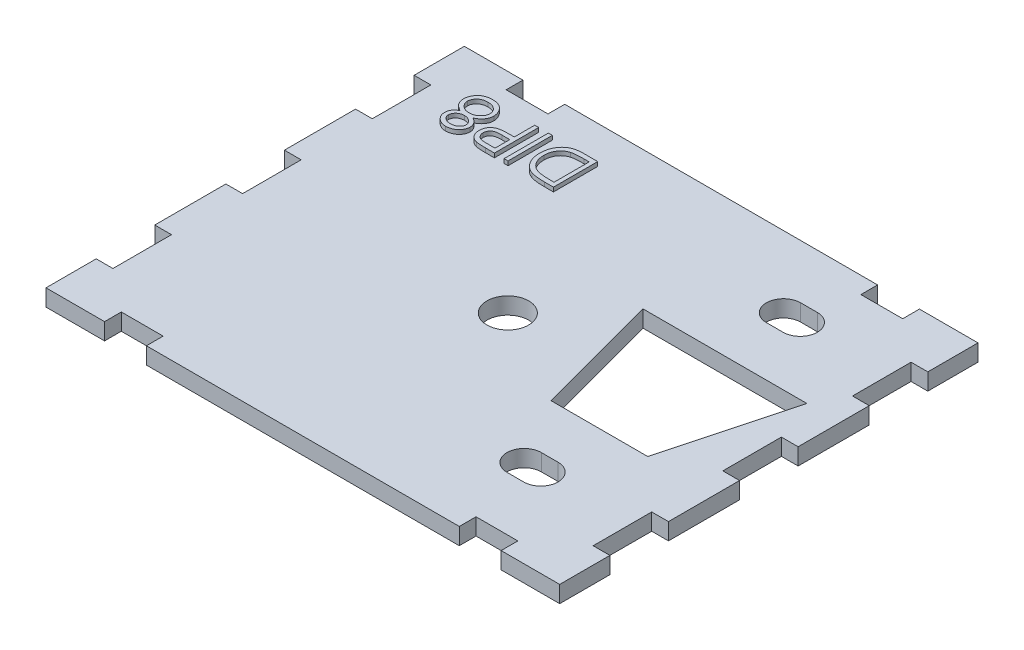
from build123d import *

# Parameters (mm, degrees)
SKETCH2_W           = 100
SKETCH2_H           = 50
BOSS_EXTRUDE1_DEPTH = 2
SKETCH12_W          = 9.8
SKETCH12_H          = 50
SKETCH12_W_2        = 8.8
CUT_EXTRUDE8_DEPTH  = 6
SKETCH13_W          = 2
SKETCH13_H          = 7
SKETCH13_W_2        = 5
SKETCH13_H_2        = 2
CUT_EXTRUDE10_DEPTH = 6
SKETCH15_W          = 6.543059906
SKETCH15_H          = 1
CUT_EXTRUDE13_DEPTH = 10
SKETCH16_R          = 2.5
CUT_EXTRUDE14_DEPTH = 10
SKETCH17_R          = 2.05
CUT_EXTRUDE15_DEPTH = 3.5
SKETCH22_W          = 0.474893163
SKETCH22_H          = 5.291666667
BOSS_EXTRUDE4_DEPTH = 0.5


with BuildPart() as part:
    # Sketch2 → Boss-Extrude1 (new body)
    with BuildSketch(Plane(origin=(0, 0, 0), x_dir=(1, 0, 0), z_dir=(0, 1, 0))):
        Rectangle(SKETCH2_W, SKETCH2_H)
    extrude(amount=BOSS_EXTRUDE1_DEPTH)

    # Sketch12 → Cut-Extrude8 (cut)
    with BuildSketch(Plane(origin=(0, 2, 0), x_dir=(1, 0, 0), z_dir=(0, 1, 0))):
        with Locations((-45.1, 0)):
            Rectangle(SKETCH12_W, SKETCH12_H)
        with Locations((45.6, 0)):
            Rectangle(SKETCH12_W_2, SKETCH12_H)
    extrude(amount=-CUT_EXTRUDE8_DEPTH, mode=Mode.SUBTRACT)

    # Sketch13 → Cut-Extrude10 (cut)
    with BuildSketch(Plane(origin=(0, 2, 0), x_dir=(1, 0, 0), z_dir=(0, 1, 0))):
        with Locations((-29.2, 0)):
            Rectangle(SKETCH13_W, SKETCH13_H)
        Polygon((-30.2, 12), (-30.2, 19), (-30.2, 25), (-40.2, 25), (-40.2, -25), (-30.2, -25), (-30.2, -19), (-30.2, -12), (-30.2, -3.5), (-30.2, 3.5), align=None)
        with Locations((-29.2, 15.5)):
            Rectangle(SKETCH13_W, SKETCH13_H)
        with Locations((21.7, -24)):
            Rectangle(SKETCH13_W_2, SKETCH13_H_2)
        with Locations((30.2, -15.5)):
            Rectangle(SKETCH13_W, SKETCH13_H)
        with Locations((30.2, 0)):
            Rectangle(SKETCH13_W, SKETCH13_H)
        with Locations((30.2, 15.5)):
            Rectangle(SKETCH13_W, SKETCH13_H)
        with Locations((21.7, 24)):
            Rectangle(SKETCH13_W_2, SKETCH13_H_2)
        with Locations((-29.2, -15.5)):
            Rectangle(SKETCH13_W, SKETCH13_H)
        Polygon((41.2, 25), (31.2, 25), (31.2, 19), (31.2, 12), (31.2, 3.5), (31.2, -3.5), (31.2, -12), (31.2, -19), (31.2, -25), (41.2, -25), align=None)
        with Locations((-20.7, 24)):
            Rectangle(SKETCH13_W_2, SKETCH13_H_2)
        with Locations((-20.7, -24)):
            Rectangle(SKETCH13_W_2, SKETCH13_H_2)
    extrude(amount=-CUT_EXTRUDE10_DEPTH, mode=Mode.SUBTRACT)

    # Sketch15 → Cut-Extrude13 (cut)
    with BuildSketch(Plane.XZ):
        Polygon((8.96933351, -7.5), (14.181143059, -7.5), (20.724202965, -7.5), (25.936012514, -7.5), (22.452673012, 5.5), (12.452673012, 5.5), align=None)
        Polygon((27.239237886, -8.5), (20.724202965, -8.5), (20.724202965, -7.5), (25.936012514, -7.5), (22.452673012, 5.5), (12.452673012, 5.5), (8.96933351, -7.5), (14.181143059, -7.5), (14.181143059, -8.5), (7.666108138, -8.5), (11.685346024, 6.5), (23.22, 6.5), align=None)
        with Locations((17.452673012, -8)):
            Rectangle(SKETCH15_W, SKETCH15_H)
    extrude(amount=-CUT_EXTRUDE13_DEPTH, mode=Mode.SUBTRACT)

    # Sketch16 → Cut-Extrude14 (cut)
    with BuildSketch(Plane(origin=(0, 0, 0), x_dir=(-1, 0, 0), z_dir=(0, -1, 0))):
        with Locations(Location((0, 0, 0), (0, 0, 90))):
            Circle(SKETCH16_R)
    extrude(amount=-CUT_EXTRUDE14_DEPTH, mode=Mode.SUBTRACT)

    # Sketch17 → Cut-Extrude15 (cut)
    with BuildSketch(Plane(origin=(0, 0, 0), x_dir=(-1, 0, 0), z_dir=(0, -1, 0))):
        with Locations((-18.452672874, -14.5)):
            Circle(SKETCH17_R)
        with Locations((-17.452672874, -14.5)):
            Circle(SKETCH17_R)
        with Locations((-16.452672874, -14.5)):
            Circle(SKETCH17_R)
        with BuildLine():
            ThreePointArc((-16.952672874, -12.511910465), (-16.704582037, -12.46553649), (-16.452672874, -12.45))
            Line((-16.452672874, -12.45), (-17.452672874, -12.45))
            ThreePointArc((-17.452672874, -12.45), (-17.200763711, -12.46553649), (-16.952672874, -12.511910465))
        make_face()
        with BuildLine():
            ThreePointArc((-17.952672874, -12.511910465), (-17.704582037, -12.46553649), (-17.452672874, -12.45))
            Line((-17.452672874, -12.45), (-18.452672874, -12.45))
            ThreePointArc((-18.452672874, -12.45), (-18.200763711, -12.46553649), (-17.952672874, -12.511910465))
        make_face()
        with BuildLine():
            Line((-17.452672874, -16.55), (-16.452672874, -16.55))
            ThreePointArc((-16.452672874, -16.55), (-16.704582037, -16.53446351), (-16.952672874, -16.488089535))
            ThreePointArc((-16.952672874, -16.488089535), (-17.200763711, -16.53446351), (-17.452672874, -16.55))
        make_face()
        with BuildLine():
            ThreePointArc((-17.952672874, -16.488089535), (-18.200763711, -16.53446351), (-18.452672874, -16.55))
            Line((-18.452672874, -16.55), (-17.452672874, -16.55))
            ThreePointArc((-17.452672874, -16.55), (-17.704582037, -16.53446351), (-17.952672874, -16.488089535))
        make_face()
        with Locations((-16.452672903, 16.5)):
            Circle(SKETCH17_R)
        with Locations((-18.452672903, 16.5)):
            Circle(SKETCH17_R)
        with Locations((-17.452672903, 16.5)):
            Circle(SKETCH17_R)
        with BuildLine():
            Line((-17.452672903, 14.45), (-16.452672903, 14.45))
            ThreePointArc((-16.452672903, 14.45), (-16.704582066, 14.46553649), (-16.952672903, 14.511910465))
            ThreePointArc((-16.952672903, 14.511910465), (-17.20076374, 14.46553649), (-17.452672903, 14.45))
        make_face()
        with BuildLine():
            ThreePointArc((-17.952672903, 14.511910465), (-18.20076374, 14.46553649), (-18.452672903, 14.45))
            Line((-18.452672903, 14.45), (-17.452672903, 14.45))
            ThreePointArc((-17.452672903, 14.45), (-17.704582066, 14.46553649), (-17.952672903, 14.511910465))
        make_face()
        with BuildLine():
            ThreePointArc((-17.952672903, 18.488089535), (-17.704582066, 18.53446351), (-17.452672903, 18.55))
            Line((-17.452672903, 18.55), (-18.452672903, 18.55))
            ThreePointArc((-18.452672903, 18.55), (-18.20076374, 18.53446351), (-17.952672903, 18.488089535))
        make_face()
        with BuildLine():
            ThreePointArc((-16.952672903, 18.488089535), (-16.704582066, 18.53446351), (-16.452672903, 18.55))
            Line((-16.452672903, 18.55), (-17.452672903, 18.55))
            ThreePointArc((-17.452672903, 18.55), (-17.20076374, 18.53446351), (-16.952672903, 18.488089535))
        make_face()
    extrude(amount=-CUT_EXTRUDE15_DEPTH, mode=Mode.SUBTRACT)

    # Sketch22 → Boss-Extrude4 (add)
    # profile 1 of 4: a face of its own
    with BuildSketch(Plane(origin=(0, 2, 0), x_dir=(1, 0, 0), z_dir=(0, 1, 0))):
        with BuildLine():
            add(Edge.make_bspline(
                [(-23.289435803, 17.591903377), (-23.332404905, 17.61448406), (-23.416471147, 17.658661691), (-23.536226688, 17.730009944), (-23.647999479, 17.802604298), (-23.749722211, 17.879054809), (-23.842392171, 17.957736407), (-23.926294543, 18.038440897), (-24.002331643, 18.120913039), (-24.067891265, 18.207273039), (-24.126059508, 18.295985161), (-24.175335145, 18.388142762), (-24.218340263, 18.482414147), (-24.252093921, 18.580230551), (-24.279961434, 18.680250068), (-24.299121538, 18.783814795), (-24.309429202, 18.890228595), (-24.31137761, 18.962147422), (-24.312364155, 18.998562365)],
                knots=[0, 0, 0, 0, 1.264219729, 2.473363326, 3.62979159, 4.734286947, 5.785533755, 6.79450939, 7.765315851, 8.704182021, 9.615576613, 10.525715488, 11.423813905, 12.311666436, 13.218214638, 14.126256791, 15.051260205, 16, 16, 16, 16], degree=3))
            add(Edge.make_bspline(
                [(-24.312364155, 18.998562365), (-24.311204378, 19.049512323), (-24.308908743, 19.150361407), (-24.288705392, 19.299170633), (-24.258862371, 19.444279836), (-24.213527962, 19.584044036), (-24.15774182, 19.719654049), (-24.087347083, 19.849282845), (-24.007897509, 19.976651469), (-23.944003353, 20.054992402), (-23.911673049, 20.094632744)],
                knots=[0, 0, 0, 0, 1.02531512, 2.029483338, 3.018748588, 4.004195107, 4.983200899, 5.966616707, 6.971112471, 8, 8, 8, 8], degree=3))
            add(Edge.make_bspline(
                [(-23.911673049, 20.094632744), (-23.869586951, 20.140887617), (-23.785934825, 20.232825779), (-23.642632065, 20.352191884), (-23.485360884, 20.452505849), (-23.314729833, 20.534257404), (-23.131195025, 20.597887215), (-22.934795566, 20.643611021), (-22.725148573, 20.669800885), (-22.581055777, 20.673586679), (-22.50713412, 20.675528845)],
                knots=[0, 0, 0, 0, 0.954267603, 1.896743057, 2.838368354, 3.796610408, 4.779680527, 5.799409237, 6.871065594, 8, 8, 8, 8], degree=3))
            add(Edge.make_bspline(
                [(-22.50713412, 20.675528845), (-22.436055991, 20.673781732), (-22.297745171, 20.670382028), (-22.096400606, 20.64747387), (-21.908487986, 20.606917675), (-21.733116378, 20.552556064), (-21.57198157, 20.480063565), (-21.424790588, 20.391208922), (-21.289386079, 20.287998182), (-21.170015852, 20.167947464), (-21.064068193, 20.039336519), (-20.970919412, 19.906693561), (-20.893932238, 19.770115131), (-20.827575478, 19.631678729), (-20.778193171, 19.488579337), (-20.743167977, 19.342285484), (-20.72116727, 19.193212775), (-20.718224786, 19.09262613), (-20.716744497, 19.04202357)],
                knots=[0, 0, 0, 0, 1.256864279, 2.445730223, 3.576845088, 4.651810441, 5.686528262, 6.692706664, 7.686234615, 8.689148594, 9.678739427, 10.630299996, 11.55097961, 12.448208961, 13.341360817, 14.221834469, 15.105450545, 16, 16, 16, 16], degree=3))
            add(Edge.make_bspline(
                [(-20.716744497, 19.04202357), (-20.717618412, 19.004892494), (-20.719345576, 18.931508382), (-20.731293861, 18.823089499), (-20.750519307, 18.717568868), (-20.776571554, 18.61452999), (-20.812202555, 18.514516547), (-20.854473631, 18.417012756), (-20.904236832, 18.322021441), (-20.963451698, 18.230988823), (-21.028691128, 18.140690304), (-21.106136334, 18.055609622), (-21.190624087, 17.970749255), (-21.287183971, 17.891269556), (-21.390601042, 17.810604383), (-21.505698429, 17.735495922), (-21.628638317, 17.660082318), (-21.716038773, 17.615019626), (-21.760873437, 17.591903377)],
                knots=[0, 0, 0, 0, 0.941575622, 1.860885767, 2.762557628, 3.660168386, 4.552890429, 5.45184204, 6.353736508, 7.268493418, 8.204037487, 9.175167802, 10.182660057, 11.238220596, 12.344046335, 13.507168087, 14.721227736, 16, 16, 16, 16], degree=3))
            add(Edge.make_bspline(
                [(-21.760873437, 17.591903377), (-21.699577858, 17.558340511), (-21.581078052, 17.493455028), (-21.422672491, 17.375729424), (-21.288489585, 17.245915039), (-21.179955341, 17.103816516), (-21.09426206, 16.95410414), (-21.033675933, 16.797566068), (-20.994129984, 16.635948219), (-20.990123942, 16.52574089), (-20.988112018, 16.470392293)],
                knots=[0, 0, 0, 0, 1.16701039, 2.256125286, 3.287752239, 4.277689688, 5.235169525, 6.160862735, 7.076343936, 8, 8, 8, 8], degree=3))
            add(Edge.make_bspline(
                [(-20.988112018, 16.470392293), (-20.99058901, 16.414004539), (-20.995568195, 16.30065532), (-21.035692113, 16.131877426), (-21.101573472, 15.966019636), (-21.18964704, 15.803466302), (-21.301731542, 15.651624337), (-21.434399213, 15.514337341), (-21.587483171, 15.395158449), (-21.757618679, 15.294413112), (-21.940381157, 15.212025645), (-22.133537089, 15.155780959), (-22.333643963, 15.118788779), (-22.46986568, 15.114612288), (-22.538935002, 15.112494657)],
                knots=[0, 0, 0, 0, 0.888724595, 1.786491426, 2.720083884, 3.697804067, 4.69440576, 5.687697823, 6.7000873, 7.744853364, 8.800284131, 9.853047784, 10.91141782, 12, 12, 12, 12], degree=3))
            add(Edge.make_bspline(
                [(-22.538935002, 15.112494657), (-22.606223043, 15.114671942), (-22.738907394, 15.1189653), (-22.934231025, 15.155126734), (-23.121279065, 15.21484513), (-23.299003181, 15.296181802), (-23.463621786, 15.397529675), (-23.610117107, 15.518020117), (-23.739685062, 15.65381121), (-23.846731579, 15.806153981), (-23.932605497, 15.968696476), (-23.994444609, 16.137306704), (-24.0335398, 16.30996329), (-24.038507636, 16.426729958), (-24.040996634, 16.485232704)],
                knots=[0, 0, 0, 0, 1.072634126, 2.115112298, 3.156050586, 4.19761425, 5.225177188, 6.230426315, 7.215180151, 8.209739481, 9.190420596, 10.139012357, 11.067603024, 12, 12, 12, 12], degree=3))
            add(Edge.make_bspline(
                [(-24.040996634, 16.485232704), (-24.038814594, 16.542644763), (-24.034529192, 16.655398782), (-23.998954414, 16.819531188), (-23.938110498, 16.972926268), (-23.856031863, 17.11794444), (-23.748301785, 17.252268321), (-23.617095434, 17.376565011), (-23.464115364, 17.493265493), (-23.348963868, 17.558289128), (-23.289435803, 17.591903377)],
                knots=[0, 0, 0, 0, 0.975463758, 1.915755378, 2.838359076, 3.772025586, 4.738400888, 5.753889765, 6.838863581, 8, 8, 8, 8], degree=3))
        make_face()
        with BuildLine():
            add(Edge.make_bspline(
                [(-22.512434267, 15.655229699), (-22.47531449, 15.656211427), (-22.402691974, 15.658132116), (-22.296228701, 15.668244), (-22.194907486, 15.687667345), (-22.098174266, 15.714277066), (-22.005697671, 15.747384889), (-21.919598353, 15.791005575), (-21.836982884, 15.839490149), (-21.760561541, 15.896360348), (-21.691380821, 15.958406963), (-21.629590243, 16.023204881), (-21.579250098, 16.092664313), (-21.535940626, 16.163310298), (-21.503777294, 16.238073053), (-21.480929572, 16.315315625), (-21.464760061, 16.395527264), (-21.463594687, 16.45017091), (-21.463005181, 16.477812499)],
                knots=[0, 0, 0, 0, 1.20353747, 2.354645537, 3.462130888, 4.543058862, 5.604822423, 6.639552563, 7.666902586, 8.706944258, 9.720926464, 10.677177239, 11.602682187, 12.496457588, 13.358248655, 14.231532794, 15.105417644, 16, 16, 16, 16], degree=3))
            add(Edge.make_bspline(
                [(-21.463005181, 16.477812499), (-21.464080303, 16.505438436), (-21.466204899, 16.560031256), (-21.481582796, 16.640972731), (-21.507294769, 16.719478164), (-21.542551413, 16.796280423), (-21.587796714, 16.871182371), (-21.642711, 16.944471028), (-21.709676985, 17.014208335), (-21.78362764, 17.082372873), (-21.864405646, 17.14517387), (-21.949288635, 17.201271158), (-22.03889609, 17.245991422), (-22.130544476, 17.285201955), (-22.226171939, 17.314614401), (-22.32511912, 17.335804335), (-22.427280324, 17.348911631), (-22.496495028, 17.350482111), (-22.531514796, 17.351276708)],
                knots=[0, 0, 0, 0, 0.873213166, 1.72559466, 2.594724523, 3.479581045, 4.391597569, 5.35687048, 6.368548091, 7.443976143, 8.534559525, 9.600545123, 10.654815915, 11.696401765, 12.749428718, 13.812189468, 14.893058657, 16, 16, 16, 16], degree=3))
            add(Edge.make_bspline(
                [(-22.531514796, 17.351276708), (-22.576496813, 17.349963671), (-22.666016561, 17.347350566), (-22.797934775, 17.322833119), (-22.926524557, 17.284755207), (-23.049352767, 17.230710492), (-23.164221069, 17.164816998), (-23.267889704, 17.087110128), (-23.356020332, 16.995764996), (-23.430997068, 16.896080311), (-23.489618261, 16.790338942), (-23.534523013, 16.683790582), (-23.560967949, 16.575557598), (-23.564405573, 16.503033178), (-23.566103471, 16.467212205)],
                knots=[0, 0, 0, 0, 1.076561449, 2.142489767, 3.202892658, 4.283174188, 5.348766409, 6.369549039, 7.375093932, 8.378927502, 9.349008457, 10.26378795, 11.142457041, 12, 12, 12, 12], degree=3))
            add(Edge.make_bspline(
                [(-23.566103471, 16.467212205), (-23.565314167, 16.442066926), (-23.563747511, 16.392157152), (-23.550314376, 16.318212536), (-23.529362787, 16.245904034), (-23.498822884, 16.175656129), (-23.46187911, 16.1058369), (-23.414787797, 16.03863664), (-23.360211652, 15.972021681), (-23.297362791, 15.908184689), (-23.22635654, 15.848252806), (-23.146618515, 15.796301252), (-23.058852377, 15.752979436), (-22.964234769, 15.716583757), (-22.861765786, 15.689552381), (-22.752327664, 15.669210289), (-22.634932936, 15.65776836), (-22.554152771, 15.656094273), (-22.512434267, 15.655229699)],
                knots=[0, 0, 0, 0, 0.814035228, 1.61574325, 2.427118093, 3.24780647, 4.092880925, 4.981933388, 5.900917883, 6.880367106, 7.87994501, 8.905470125, 9.95492938, 11.0455354, 12.184050453, 13.382997595, 14.64846247, 16, 16, 16, 16], degree=3))
        make_face(mode=Mode.SUBTRACT)
        with BuildLine():
            add(Edge.make_bspline(
                [(-22.543175119, 17.894011751), (-22.496116025, 17.894849043), (-22.403797565, 17.896491606), (-22.268545382, 17.914766395), (-22.138750223, 17.940223154), (-22.014810536, 17.978778768), (-21.897362521, 18.028944861), (-21.784753311, 18.088433254), (-21.678746335, 18.159735969), (-21.579815409, 18.241123996), (-21.489241489, 18.329322244), (-21.409489888, 18.422471375), (-21.342111092, 18.519306541), (-21.287432444, 18.619950223), (-21.245014196, 18.724180672), (-21.213708873, 18.832058714), (-21.195533045, 18.943885259), (-21.192943361, 19.019699148), (-21.191637659, 19.05792401)],
                knots=[0, 0, 0, 0, 1.140332253, 2.237053636, 3.304055028, 4.344690294, 5.377465719, 6.397042765, 7.428360044, 8.469453732, 9.499453352, 10.490108612, 11.438398528, 12.354680514, 13.261581007, 14.161901135, 15.073242693, 16, 16, 16, 16], degree=3))
            add(Edge.make_bspline(
                [(-21.191637659, 19.05792401), (-21.193736865, 19.105436245), (-21.197916883, 19.200044447), (-21.229889104, 19.339513735), (-21.282396734, 19.474495236), (-21.356058748, 19.603085246), (-21.445909182, 19.723724669), (-21.555139911, 19.83036229), (-21.681087775, 19.921562602), (-21.822718051, 19.997787354), (-21.977972565, 20.058158391), (-22.145891871, 20.101349747), (-22.325338543, 20.12849734), (-22.449086216, 20.131339079), (-22.512434267, 20.132793802)],
                knots=[0, 0, 0, 0, 0.899105568, 1.790333855, 2.694925079, 3.632758987, 4.588257081, 5.534574046, 6.511571685, 7.523527334, 8.572244311, 9.657983075, 10.801090915, 12, 12, 12, 12], degree=3))
            add(Edge.make_bspline(
                [(-22.512434267, 20.132793802), (-22.561946272, 20.131832001), (-22.658411534, 20.129958104), (-22.79919616, 20.113761674), (-22.931741394, 20.087305183), (-23.05731706, 20.051433018), (-23.174988471, 20.00388132), (-23.284595238, 19.944817552), (-23.387629904, 19.877353963), (-23.479688966, 19.797482909), (-23.563393287, 19.71201594), (-23.636711674, 19.622016397), (-23.698761577, 19.528385631), (-23.74877976, 19.431178451), (-23.788498975, 19.330752085), (-23.817132006, 19.226694282), (-23.834779351, 19.118596315), (-23.836565569, 19.045270882), (-23.837470993, 19.00810263)],
                knots=[0, 0, 0, 0, 1.224631902, 2.385975653, 3.500340538, 4.565441647, 5.612488581, 6.63322211, 7.641830068, 8.652595074, 9.641693811, 10.598750962, 11.520088299, 12.415429315, 13.298523938, 14.187139574, 15.081071174, 16, 16, 16, 16], degree=3))
            add(Edge.make_bspline(
                [(-23.837470993, 19.00810263), (-23.836110484, 18.971998254), (-23.833427799, 18.900806732), (-23.816156573, 18.795386006), (-23.786507588, 18.69311897), (-23.743274369, 18.594466875), (-23.69018178, 18.49828214), (-23.624595492, 18.40537225), (-23.547314869, 18.315479941), (-23.45852907, 18.230455999), (-23.362305315, 18.151855224), (-23.260329144, 18.082004429), (-23.152135819, 18.024914734), (-23.039868607, 17.976955371), (-22.922395756, 17.939580332), (-22.800283876, 17.913372465), (-22.673301633, 17.896900838), (-22.587040661, 17.89498566), (-22.543175119, 17.894011751)],
                knots=[0, 0, 0, 0, 0.917336384, 1.808827106, 2.706624561, 3.615530867, 4.539869921, 5.493819324, 6.499753197, 7.547410123, 8.613069608, 9.653934021, 10.682176708, 11.716048074, 12.752411263, 13.808993382, 14.885826486, 16, 16, 16, 16], degree=3))
        make_face(mode=Mode.SUBTRACT)
    # profile 2 of 4: a face of its own
    with BuildSketch(Plane(origin=(0, 2, 0), x_dir=(1, 0, 0), z_dir=(0, 1, 0))):
        with BuildLine():
            Line((-16.849757317, 15.248178417), (-17.887526081, 15.248178417))
            add(Edge.make_bspline(
                [(-17.887526081, 15.248178417), (-17.958904475, 15.24825688), (-18.095668647, 15.248407217), (-18.291785458, 15.252965225), (-18.469902552, 15.2590532), (-18.629635866, 15.267492491), (-18.771476871, 15.277465907), (-18.894783741, 15.29145411), (-19.000525689, 15.306059556), (-19.06388425, 15.320908588), (-19.092779486, 15.327680621)],
                knots=[0, 0, 0, 0, 1.415646017, 2.712440637, 3.8905458, 4.950247383, 5.884950622, 6.709939814, 7.411656543, 8, 8, 8, 8], degree=3))
            add(Edge.make_bspline(
                [(-19.092779486, 15.327680621), (-19.129357573, 15.337692681), (-19.201651829, 15.357480878), (-19.305827007, 15.39710916), (-19.404925695, 15.44411866), (-19.499362415, 15.497616299), (-19.587519359, 15.560128491), (-19.672148956, 15.628047242), (-19.7514764, 15.704119349), (-19.824303874, 15.788244656), (-19.891781673, 15.877667251), (-19.948265428, 15.974667362), (-19.998142805, 16.075880016), (-20.0370127, 16.18377635), (-20.06756593, 16.296932148), (-20.089817881, 16.415641918), (-20.104119685, 16.539649576), (-20.105476746, 16.624409671), (-20.106167574, 16.667557758)],
                knots=[0, 0, 0, 0, 0.999333726, 1.975119402, 2.933498163, 3.889020618, 4.832249799, 5.779334906, 6.747801194, 7.724875447, 8.710438469, 9.696133548, 10.679360639, 11.681339199, 12.714023775, 13.766351759, 14.862936069, 16, 16, 16, 16], degree=3))
            add(Edge.make_bspline(
                [(-20.106167574, 16.667557758), (-20.10553042, 16.711067015), (-20.104283785, 16.796195817), (-20.089321544, 16.920735628), (-20.069167564, 17.039750337), (-20.038177973, 17.152976053), (-19.997589872, 17.259740373), (-19.949976887, 17.361674855), (-19.892549407, 17.457045311), (-19.826562581, 17.546197977), (-19.753157194, 17.629216535), (-19.672643823, 17.705499379), (-19.585347512, 17.774599986), (-19.491545693, 17.836673267), (-19.390323898, 17.890279785), (-19.283217308, 17.938293806), (-19.169294957, 17.978617909), (-19.090460442, 17.999830026), (-19.050378311, 18.010614983)],
                knots=[0, 0, 0, 0, 1.121902311, 2.195077645, 3.232258892, 4.234102512, 5.217864754, 6.176164875, 7.132989551, 8.084763148, 9.034132444, 9.988522005, 10.94243251, 11.903244335, 12.886203696, 13.894208494, 14.929344452, 16, 16, 16, 16], degree=3))
            add(Edge.make_bspline(
                [(-19.050378311, 18.010614983), (-19.017225893, 18.017659712), (-18.944570441, 18.033098645), (-18.824921685, 18.050451574), (-18.685544292, 18.064682872), (-18.526912485, 18.077963633), (-18.348656338, 18.085000776), (-18.151184687, 18.09326353), (-17.933829219, 18.097162272), (-17.782230557, 18.097408721), (-17.703080969, 18.097537392)],
                knots=[0, 0, 0, 0, 0.601372724, 1.317943291, 2.144091499, 3.08771165, 4.142394186, 5.309582461, 6.595334295, 8, 8, 8, 8], degree=3))
            Line((-17.703080969, 18.097537392), (-17.32465048, 18.097537392))
            Line((-17.32465048, 18.097537392), (-17.32465048, 20.539845084))
            Line((-17.32465048, 20.539845084), (-16.849757317, 20.539845084))
            Line((-16.849757317, 20.539845084), (-16.849757317, 15.248178417))
        make_face()
        with BuildLine():
            Line((-17.32465048, 15.79091346), (-17.32465048, 17.554802349))
            Line((-17.32465048, 17.554802349), (-18.251116158, 17.566462672))
            add(Edge.make_bspline(
                [(-18.251116158, 17.566462672), (-18.296352998, 17.5664925), (-18.383681785, 17.566550082), (-18.510171515, 17.560421484), (-18.627242279, 17.553754261), (-18.735066925, 17.542971778), (-18.833153313, 17.529820509), (-18.921738923, 17.512237197), (-19.001530711, 17.494303354), (-19.093442015, 17.463184955), (-19.196392314, 17.4162389), (-19.308129847, 17.346119114), (-19.403600406, 17.257785816), (-19.485518732, 17.157394105), (-19.550269573, 17.045594913), (-19.597197314, 16.926308405), (-19.625841034, 16.799987531), (-19.629441306, 16.713641524), (-19.631274411, 16.669677816)],
                knots=[0, 0, 0, 0, 1.160501667, 2.240324542, 3.248665471, 4.168823117, 5.020172044, 5.786515869, 6.485785279, 7.116517804, 8.272762037, 9.381837012, 10.485674779, 11.594342068, 12.695271952, 13.786226926, 14.872841088, 16, 16, 16, 16], degree=3))
            add(Edge.make_bspline(
                [(-19.631274411, 16.669677816), (-19.629359524, 16.627138412), (-19.625552964, 16.54257534), (-19.597433922, 16.418581872), (-19.549772594, 16.300651465), (-19.485465943, 16.189738386), (-19.405510669, 16.089613502), (-19.311938821, 16.003248829), (-19.206206234, 15.933346739), (-19.108619451, 15.886813583), (-19.021286965, 15.859525505), (-18.945795973, 15.839824894), (-18.860125246, 15.826237802), (-18.765085548, 15.81323751), (-18.660798562, 15.802743445), (-18.546601151, 15.795456031), (-18.422873698, 15.791235826), (-18.336981928, 15.791023517), (-18.292457304, 15.79091346)],
                knots=[0, 0, 0, 0, 1.12039168, 2.227199994, 3.330242575, 4.460839274, 5.593542475, 6.693949254, 7.801736126, 8.92216649, 9.528704869, 10.210659466, 10.975987387, 11.81211542, 12.738540127, 13.736887663, 14.826846554, 16, 16, 16, 16], degree=3))
            Line((-18.292457304, 15.79091346), (-17.32465048, 15.79091346))
        make_face(mode=Mode.SUBTRACT)
    # profile 3 of 4: a face of its own
    with BuildSketch(Plane(origin=(0, 2, 0), x_dir=(1, 0, 0), z_dir=(0, 1, 0))):
        with Locations((-15.458998771, 17.89401175)):
            Rectangle(SKETCH22_W, SKETCH22_H)
    # profile 4 of 4: a face of its own
    with BuildSketch(Plane(origin=(0, 2, 0), x_dir=(1, 0, 0), z_dir=(0, 1, 0))):
        with BuildLine():
            Line((-9.794201762, 20.539845084), (-9.794201762, 15.248178417))
            Line((-9.794201762, 15.248178417), (-10.862711377, 15.248178417))
            add(Edge.make_bspline(
                [(-10.862711377, 15.248178417), (-10.955646826, 15.248845718), (-11.135197631, 15.250134939), (-11.394656719, 15.258355989), (-11.634380243, 15.272752196), (-11.854232067, 15.294126465), (-12.054565401, 15.319781578), (-12.235059386, 15.352408477), (-12.396006529, 15.39077992), (-12.494989894, 15.423507319), (-12.541797916, 15.438983706)],
                knots=[0, 0, 0, 0, 1.314317071, 2.539253741, 3.67075822, 4.709970291, 5.662644612, 6.526156501, 7.303037452, 8, 8, 8, 8], degree=3))
            add(Edge.make_bspline(
                [(-12.541797916, 15.438983706), (-12.60302758, 15.462306224), (-12.724098423, 15.508422383), (-12.896386852, 15.595547119), (-13.059127226, 15.693859614), (-13.211034541, 15.805613833), (-13.352443516, 15.929381688), (-13.485133382, 16.064161799), (-13.605300833, 16.21355234), (-13.717090477, 16.372917778), (-13.814935421, 16.543708371), (-13.901215858, 16.722503207), (-13.974886252, 16.908955371), (-14.032368948, 17.104425318), (-14.079859589, 17.307035637), (-14.111724644, 17.518320336), (-14.132891318, 17.737047608), (-14.135008075, 17.885479957), (-14.136082104, 17.960793602)],
                knots=[0, 0, 0, 0, 0.984696416, 1.947063185, 2.89840987, 3.841051395, 4.778753227, 5.721858861, 6.681155121, 7.65838316, 8.646299769, 9.637283673, 10.641736726, 11.657050558, 12.698485921, 13.768600492, 14.86780186, 16, 16, 16, 16], degree=3))
            add(Edge.make_bspline(
                [(-14.136082104, 17.960793602), (-14.135130523, 18.026200252), (-14.133255335, 18.155090889), (-14.116438052, 18.345051132), (-14.09194744, 18.529361241), (-14.054204692, 18.707211928), (-14.007827279, 18.879800613), (-13.950585726, 19.046310112), (-13.882739951, 19.206853596), (-13.804058122, 19.360155912), (-13.71790473, 19.505844287), (-13.624026466, 19.641610381), (-13.525637661, 19.768951073), (-13.4191499, 19.884989597), (-13.308088882, 19.993339426), (-13.188677268, 20.089194152), (-13.064653977, 20.177003811), (-12.932292989, 20.254101774), (-12.790508332, 20.322682703), (-12.63559639, 20.38059971), (-12.468122548, 20.430441608), (-12.286977089, 20.470152222), (-12.092764151, 20.502160991), (-11.884957268, 20.523477188), (-11.66394557, 20.53793223), (-11.512181182, 20.539195085), (-11.434067213, 20.539845084)],
                knots=[0, 0, 0, 0, 1.105894396, 2.179280415, 3.222964075, 4.248423888, 5.251546139, 6.243661943, 7.223682738, 8.196462441, 9.155694589, 10.083899862, 10.986397372, 11.874737962, 12.745335529, 13.607670254, 14.461432187, 15.313100333, 16.195087267, 17.121790994, 18.106827133, 19.14775296, 20.255889161, 21.433815148, 22.679170477, 24, 24, 24, 24], degree=3))
            Line((-11.434067213, 20.539845084), (-9.794201762, 20.539845084))
        make_face()
        with BuildLine():
            Line((-10.269094924, 19.997110041), (-10.876491759, 19.997110041))
            add(Edge.make_bspline(
                [(-10.876491759, 19.997110041), (-10.963771558, 19.996734943), (-11.131642575, 19.996013492), (-11.373030261, 19.98968284), (-11.593586015, 19.979338482), (-11.793341154, 19.964861876), (-11.972182893, 19.945708137), (-12.130484991, 19.924352629), (-12.267728537, 19.897746959), (-12.350776614, 19.873630628), (-12.389153685, 19.86248631)],
                knots=[0, 0, 0, 0, 1.375205317, 2.645023457, 3.804390687, 4.853969522, 5.800190428, 6.637939096, 7.370582563, 8, 8, 8, 8], degree=3))
            add(Edge.make_bspline(
                [(-12.389153685, 19.86248631), (-12.437457592, 19.845476297), (-12.532911669, 19.811862553), (-12.670300372, 19.750524854), (-12.798499649, 19.677957626), (-12.919646715, 19.596817328), (-13.032962998, 19.505851075), (-13.137923739, 19.404769574), (-13.235357997, 19.294743066), (-13.323705759, 19.175400814), (-13.4036093, 19.048066979), (-13.472645697, 18.912883401), (-13.530842597, 18.770608682), (-13.578589285, 18.62173782), (-13.61581533, 18.466182211), (-13.64202393, 18.30355149), (-13.658265092, 18.133909881), (-13.660203698, 18.018425372), (-13.661188941, 17.959733572)],
                knots=[0, 0, 0, 0, 0.998420628, 1.972994, 2.929372424, 3.86770908, 4.81360496, 5.759023883, 6.706048443, 7.676227424, 8.651287839, 9.634325482, 10.632389399, 11.645655052, 12.680158286, 13.74837235, 14.855672678, 16, 16, 16, 16], degree=3))
            add(Edge.make_bspline(
                [(-13.661188941, 17.959733572), (-13.660412073, 17.897846419), (-13.658885907, 17.776268559), (-13.639735283, 17.597872612), (-13.611689968, 17.426319709), (-13.571348971, 17.261486341), (-13.519231881, 17.103586959), (-13.456869559, 16.951729499), (-13.38115191, 16.807868222), (-13.295431527, 16.670784678), (-13.199194698, 16.542554911), (-13.092868326, 16.4246812), (-12.977573557, 16.316943975), (-12.85384175, 16.219171701), (-12.719942925, 16.133103123), (-12.578142913, 16.05653786), (-12.426444272, 15.991483459), (-12.320892138, 15.956895335), (-12.267250306, 15.939317573)],
                knots=[0, 0, 0, 0, 1.122272916, 2.204715076, 3.251197285, 4.274229216, 5.279697671, 6.265416158, 7.248880903, 8.225321784, 9.195852973, 10.153576302, 11.101466393, 12.055578741, 13.010401466, 13.985536859, 14.976245305, 16, 16, 16, 16], degree=3))
            add(Edge.make_bspline(
                [(-12.267250306, 15.939317573), (-12.222874168, 15.927046307), (-12.128518323, 15.900954229), (-11.974546753, 15.872492059), (-11.801259563, 15.847387638), (-11.607887395, 15.826133221), (-11.394650678, 15.810882152), (-11.161385411, 15.799435045), (-10.907990771, 15.791714303), (-10.732333845, 15.791187091), (-10.641165237, 15.79091346)],
                knots=[0, 0, 0, 0, 0.674548936, 1.434276114, 2.292660221, 3.240891867, 4.284742987, 5.42552168, 6.663806718, 8, 8, 8, 8], degree=3))
            Line((-10.641165237, 15.79091346), (-10.269094924, 15.79091346))
            Line((-10.269094924, 15.79091346), (-10.269094924, 19.997110041))
        make_face(mode=Mode.SUBTRACT)
    extrude(amount=BOSS_EXTRUDE4_DEPTH)


solid = part.part
